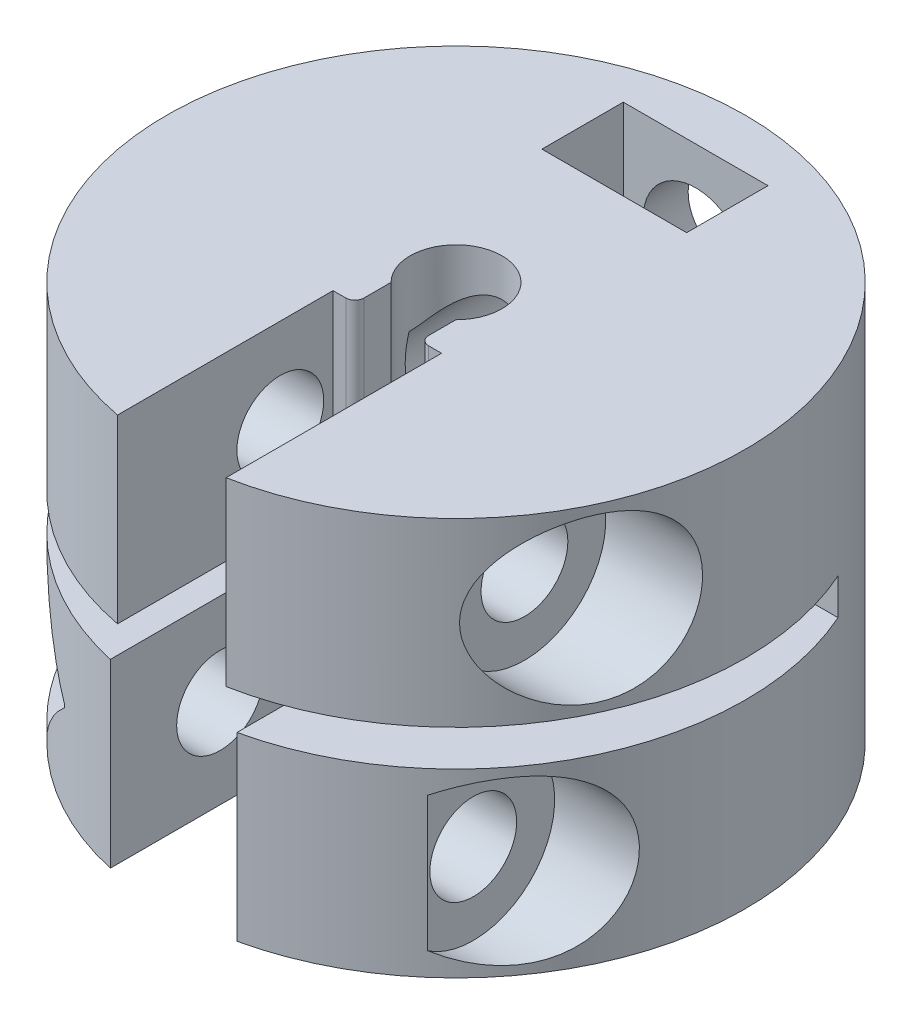
from build123d import *

# Parameters (mm, degrees)
SKETCH1_W                            = 4.75
SKETCH1_H                            = 7
FILLET1_R                            = 1
SKETCH16_W                           = 16
SKETCH16_H                           = 1
CUT_EXTRUDE5_DEPTH                   = 1
CUT_EXTRUDE5_DIRECTION_2_REACH       = 18.492
CUT_EXTRUDE6_REACH                   = 15.304
SKETCH17_W                           = 3.5
SKETCH17_H                           = 5.261387212
CUT_EXTRUDE7_DEPTH                   = 18.408690359
CUT_EXTRUDE7_DEPTH_BACK              = 18.408690359
SKETCH18_R                           = 1.2
CUT_EXTRUDE10_START                  = -6
SKETCH21_R                           = 1.27
CUT_EXTRUDE10_DEPTH                  = 6
CUT_EXTRUDE11_DEPTH                  = 18.26991621
CUT_EXTRUDE11_DEPTH_BACK             = 18.26991621
SKETCH22_R                           = 1.2
CUT_EXTRUDE9_REACH                   = 20.603
CUT_EXTRUDE9_END_RADIUS              = 8
SKETCH20_R                           = 1.2
CUT_EXTRUDE12_REACH                  = 21.585
SKETCH19_R                           = 2.25
CUT_EXTRUDE13_REACH                  = 21.585
CUT_EXTRUDE13_END_RADIUS             = 8
SKETCH24_R                           = 2.25
CUT_EXTRUDE14_REACH                  = 18.492
CUT_EXTRUDE14_END_RADIUS             = 8
SKETCH25_W                           = 2.25
SKETCH25_H                           = 1
CUT_EXTRUDE14_DIRECTION_2_REACH      = 18.492
CUT_EXTRUDE14_DIRECTION_2_END_RADIUS = 8
M2_5_CLEARANCE_HOLE1_D               = 2.9
M2_5_CLEARANCE_HOLE1_DEPTH           = 8.029752102
M2_5_CLEARANCE_HOLE1_TIP             = 0.871247898
CUT_EXTRUDE15_START                  = -12
SKETCH29_W                           = 4
SKETCH29_H                           = 2.25
CUT_EXTRUDE15_DEPTH                  = 12
FILLET3_R                            = 0.25
SKETCH30_R                           = 8
CUT_EXTRUDE19_DEPTH                  = 1
BOSS_EXTRUDE1_START                  = 1
BOSS_EXTRUDE1_DEPTH                  = 1


with BuildPart() as part:
    # Sketch1 → Revolve1 (revolve)
    with BuildSketch(Plane.XY, mode=Mode.PRIVATE) as revolve1_sk:
        with Locations((5.625, 3.5)):
            Rectangle(SKETCH1_W, SKETCH1_H)
    revolve(revolve1_sk.sketch.rotate(Axis((0, 0, 0), (0, 1, 0)), 90), axis=Axis((0, 0, 0), (0, 1, 0)))

    # Sketch1<3> → Revolve2 (revolve)
    with BuildSketch(Plane.XY, mode=Mode.PRIVATE) as revolve2_sk:
        Polygon((1.27, 7), (3.25, 7), (8, 7), (8, 12), (1.27, 12), align=None)
    revolve(revolve2_sk.sketch.rotate(Axis((0, 0, 0), (0, 1, 0)), 90), axis=Axis((0, 0, 0), (0, 1, 0)))

    # Fillet1
    fillet1_edges = [part.edges().sort_by_distance(p)[0] for p in [
        (0, 12, 8),
    ]]
    fillet(fillet1_edges, radius=FILLET1_R)

    # Sketch16 → Cut-Extrude5 (cut)
    with BuildSketch(Plane.XY):
        with Locations((0, 5.5)):
            Rectangle(SKETCH16_W, SKETCH16_H)
    extrude(amount=-CUT_EXTRUDE5_DEPTH, mode=Mode.SUBTRACT)

    # Sketch16 → Cut-Extrude5 direction 2 (cut, up to next)
    with BuildSketch(Plane.XY, mode=Mode.PRIVATE) as cut_extrude5_direction_2_sk1:
        with Locations((0, 5.5)):
            Rectangle(SKETCH16_W, SKETCH16_H)
    cut_extrude5_direction_2_tool1 = extrude(cut_extrude5_direction_2_sk1.sketch, amount=CUT_EXTRUDE5_DIRECTION_2_REACH, mode=Mode.PRIVATE) & part.part
    add(cut_extrude5_direction_2_tool1.solids().sort_by_distance((0, 5.5, 0))[0], mode=Mode.SUBTRACT)

    # Sketch17 → Cut-Extrude6 (cut, up to next)
    with BuildSketch(Plane(origin=(0, 5, 0), x_dir=(1, 0, 0), z_dir=(0, 1, 0)), mode=Mode.PRIVATE) as cut_extrude6_sk1:
        with Locations((0, -5.369306394)):
            Rectangle(SKETCH17_W, SKETCH17_H)
    cut_extrude6_tool1 = extrude(cut_extrude6_sk1.sketch, amount=-CUT_EXTRUDE6_REACH, mode=Mode.PRIVATE) & part.part
    add(cut_extrude6_tool1.solids().sort_by_distance((0, 5, 5.369306))[0], mode=Mode.SUBTRACT)

    # Sketch18 → Cut-Extrude7 (cut, two sides: drawn at the far end of the back side and taken through both)
    with BuildSketch(Plane.ZY.offset(-1.75).offset(-CUT_EXTRUDE7_DEPTH_BACK)):
        with Locations((4.772430143, 2.5)):
            Circle(SKETCH18_R)
    extrude(amount=CUT_EXTRUDE7_DEPTH + CUT_EXTRUDE7_DEPTH_BACK, mode=Mode.SUBTRACT)

    # Sketch21 → Cut-Extrude10 (cut)
    with BuildSketch(Plane(origin=(0, 12, 0), x_dir=(1, 0, 0), z_dir=(0, 1, 0)).offset(CUT_EXTRUDE10_START)):
        Circle(SKETCH21_R)
        Polygon((-1.5, -1.9), (-1.5, -11.891029443), (1.5, -11.891029443), (1.5, -1.9), (0.896046874, -1.9), (0.896046874, -0.9), (-0.896046874, -0.9), (-0.896046874, -1.9), align=None)
    extrude(amount=CUT_EXTRUDE10_DEPTH, mode=Mode.SUBTRACT)

    # Sketch22 → Cut-Extrude11 (cut, two sides: drawn at the far end of the back side and taken through both)
    with BuildSketch(Plane(origin=(-1.5, 0, 0), x_dir=(0, 0, -1), z_dir=(1, 0, 0)).offset(-CUT_EXTRUDE11_DEPTH_BACK)):
        with Locations((-3.358116823, 8.5)):
            Circle(SKETCH22_R)
    extrude(amount=CUT_EXTRUDE11_DEPTH + CUT_EXTRUDE11_DEPTH_BACK, mode=Mode.SUBTRACT)

    # Cut-Extrude9: up to this cylinder (the profile starts inside it)
    cut_extrude9_end = Plane(origin=(0, 5.9847245, 0), z_dir=(0, -1, 0)) * Cylinder(CUT_EXTRUDE9_END_RADIUS, 65.175449, mode=Mode.PRIVATE)
    # Sketch20 → Cut-Extrude9 (cut, up to the surface)
    with BuildSketch(Plane(origin=(-3.75, 0, 0), x_dir=(0, 0, -1), z_dir=(1, 0, 0)), mode=Mode.PRIVATE) as cut_extrude9_sk1:
        Polygon((-2.463029066, 2.5), (-3.617729604, 4.5), (-5.927130681, 4.5), (-7.08183122, 2.5), (-5.927130681, 0.5), (-3.617729604, 0.5), align=None)
    cut_extrude9_tool1 = extrude(cut_extrude9_sk1.sketch, amount=-CUT_EXTRUDE9_REACH, mode=Mode.PRIVATE) & cut_extrude9_end
    add(cut_extrude9_tool1.solids().sort_by_distance((-3.75, 2.5, 4.77243))[0], mode=Mode.SUBTRACT)
    # Sketch20 → Cut-Extrude9 (cut, up to the surface)
    with BuildSketch(Plane(origin=(-3.75, 0, 0), x_dir=(0, 0, -1), z_dir=(1, 0, 0)), mode=Mode.PRIVATE) as cut_extrude9_sk2:
        Polygon((-1.048715746, 8.5), (-2.203416284, 10.5), (-4.512817361, 10.5), (-5.6675179, 8.5), (-4.512817361, 6.5), (-2.203416284, 6.5), align=None)
        with Locations((-3.358116823, 8.5)):
            Circle(SKETCH20_R, mode=Mode.SUBTRACT)
    cut_extrude9_tool2 = extrude(cut_extrude9_sk2.sketch, amount=-CUT_EXTRUDE9_REACH, mode=Mode.PRIVATE) & cut_extrude9_end
    add(cut_extrude9_tool2.solids().sort_by_distance((-3.75, 9.469449, 1.678981))[0], mode=Mode.SUBTRACT)

    # Sketch19 → Cut-Extrude12 (cut, up to next)
    with BuildSketch(Plane.ZY.offset(-5.25), mode=Mode.PRIVATE) as cut_extrude12_sk1:
        with Locations((4.772430143, 2.5)):
            Circle(SKETCH19_R)
    cut_extrude12_tool1 = extrude(cut_extrude12_sk1.sketch, amount=-CUT_EXTRUDE12_REACH, mode=Mode.PRIVATE) & part.part
    add(cut_extrude12_tool1.solids().sort_by_distance((5.25, 2.5, 4.77243))[0], mode=Mode.SUBTRACT)

    # Cut-Extrude13: up to this cylinder (the profile starts inside it)
    cut_extrude13_end = Plane(origin=(0, 8.5, 0), z_dir=(0, -1, 0)) * Cylinder(CUT_EXTRUDE13_END_RADIUS, 60.17, mode=Mode.PRIVATE)
    # Sketch24 → Cut-Extrude13 (cut, up to the surface)
    with BuildSketch(Plane.ZY.offset(-5.25), mode=Mode.PRIVATE) as cut_extrude13_sk1:
        with Locations((3.358116823, 8.5)):
            Circle(SKETCH24_R)
    cut_extrude13_tool1 = extrude(cut_extrude13_sk1.sketch, amount=-CUT_EXTRUDE13_REACH, mode=Mode.PRIVATE) & cut_extrude13_end
    add(cut_extrude13_tool1.solids().sort_by_distance((5.25, 8.5, 3.358117))[0], mode=Mode.SUBTRACT)

    # Cut-Extrude14: up to this cylinder (the profile starts inside it)
    cut_extrude14_end = Plane(origin=(0, 5.5, 0), z_dir=(0, -1, 0)) * Cylinder(CUT_EXTRUDE14_END_RADIUS, 53.984, mode=Mode.PRIVATE)
    # Sketch25 → Cut-Extrude14 (cut, up to the surface)
    with BuildSketch(Plane.ZY, mode=Mode.PRIVATE) as cut_extrude14_sk1:
        with Locations((-2.125, 5.5)):
            Rectangle(SKETCH25_W, SKETCH25_H)
    cut_extrude14_tool1 = extrude(cut_extrude14_sk1.sketch, amount=-CUT_EXTRUDE14_REACH, mode=Mode.PRIVATE) & cut_extrude14_end
    add(cut_extrude14_tool1.solids().sort_by_distance((0, 5.5, -2.125))[0], mode=Mode.SUBTRACT)

    # Cut-Extrude14 direction 2: up to this cylinder (the profile starts inside it)
    cut_extrude14_direction_2_end = Plane(origin=(0, 5.5, 0), z_dir=(0, -1, 0)) * Cylinder(CUT_EXTRUDE14_DIRECTION_2_END_RADIUS, 53.984, mode=Mode.PRIVATE)
    # Sketch25 → Cut-Extrude14 direction 2 (cut, up to the surface)
    with BuildSketch(Plane.ZY, mode=Mode.PRIVATE) as cut_extrude14_direction_2_sk1:
        with Locations((-2.125, 5.5)):
            Rectangle(SKETCH25_W, SKETCH25_H)
    cut_extrude14_direction_2_tool1 = extrude(cut_extrude14_direction_2_sk1.sketch, amount=CUT_EXTRUDE14_DIRECTION_2_REACH, mode=Mode.PRIVATE) & cut_extrude14_direction_2_end
    add(cut_extrude14_direction_2_tool1.solids().sort_by_distance((0, 5.5, -2.125))[0], mode=Mode.SUBTRACT)

    # M2.5 Clearance Hole1
    with Locations(Plane(origin=(0, 0, -8), x_dir=(-1, 0, 0), z_dir=(0, 0, -1))):
        with Locations((0, 8.5), (0, 2.5)):
            Hole(M2_5_CLEARANCE_HOLE1_D / 2, depth=M2_5_CLEARANCE_HOLE1_DEPTH)
            with Locations((0, 0, -(M2_5_CLEARANCE_HOLE1_DEPTH + M2_5_CLEARANCE_HOLE1_TIP / 2))):  # 118° drill point
                Cone(0, M2_5_CLEARANCE_HOLE1_D / 2, M2_5_CLEARANCE_HOLE1_TIP, mode=Mode.SUBTRACT)

    # Sketch29 → Cut-Extrude15 (cut)
    with BuildSketch(Plane(origin=(0, 12, 0), x_dir=(1, 0, 0), z_dir=(0, 1, 0)).offset(CUT_EXTRUDE15_START)):
        with Locations((0, 5.5)):
            Rectangle(SKETCH29_W, SKETCH29_H)
    extrude(amount=CUT_EXTRUDE15_DEPTH, mode=Mode.SUBTRACT)

    # Fillet3
    fillet3_edges = [part.edges().sort_by_distance(p)[0] for p in [
        (0.896046874, 9.5, 1.9),
        (-0.896046874, 9.5, 1.9),
    ]]
    fillet(fillet3_edges, radius=FILLET3_R)

    # Sketch30 → Cut-Extrude19 (cut)
    with BuildSketch(Plane(origin=(0, 12, 0), x_dir=(1, 0, 0), z_dir=(0, 1, 0))):
        Circle(SKETCH30_R)
    extrude(amount=-CUT_EXTRUDE19_DEPTH, mode=Mode.SUBTRACT)

    # Sketch31 → Boss-Extrude1 (add)
    with BuildSketch(Plane.XZ.offset(-7).offset(BOSS_EXTRUDE1_START)):
        with BuildLine():
            Line((-0.896046874, 0.9), (-0.896046874, 1.65))
            ThreePointArc((-0.896046874, 1.65), (-0.969270178, 1.826776695), (-1.146046874, 1.9))
            Line((-1.146046874, 1.9), (-1.5, 1.9))
            Line((-1.5, 1.9), (-1.5, 2.883140649))
            ThreePointArc((-1.5, 2.883140649), (0, -3.25), (1.5, 2.883140649))
            Line((1.5, 2.883140649), (1.5, 1.9))
            Line((1.5, 1.9), (1.146046874, 1.9))
            ThreePointArc((1.146046874, 1.9), (0.969270178, 1.826776695), (0.896046874, 1.65))
            Line((0.896046874, 1.65), (0.896046874, 0.9))
            ThreePointArc((0.896046874, 0.9), (0, -1.27), (-0.896046874, 0.9))
        make_face()
    extrude(amount=-BOSS_EXTRUDE1_DEPTH)


solid = part.part
